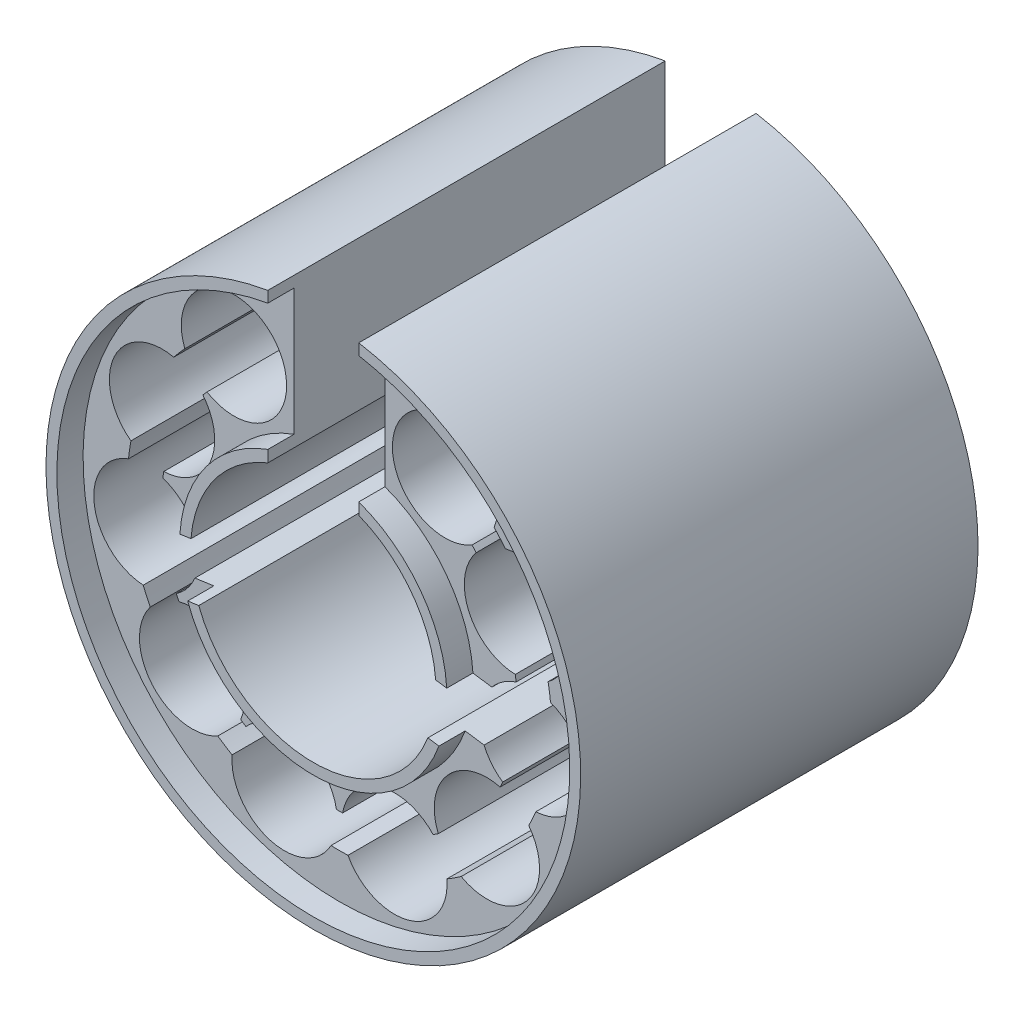
from build123d import *

# Parameters (mm, degrees)
BASIC_SHAPE_SKETCH_R                = 49
BASIC_SHAPE_SKETCH_R_2              = 22.5
BASIC_SHAPE_DEPTH                   = 68.03
SLIT_DEPTH                          = 98.108603635
BATTERY_SLOT_SKETCH_R               = 9.65
BATTERY_SLOT_DEPTH                  = 67.03
PATTERN_BATTERY_SLOT_COUNT          = 5
PATTERN_BATTERY_SLOT_ANGLE          = 130.88
MIRROR_BATTERY_SLOT_COPY_1_SKETCH_R = 9.65
MIRROR_BATTERY_SLOT_COPY_1_DEPTH    = 67.03
MIRROR_BATTERY_SLOT_COPY_2_SKETCH_R = 9.65
MIRROR_BATTERY_SLOT_COPY_2_DEPTH    = 67.03
MIRROR_BATTERY_SLOT_COPY_3_SKETCH_R = 9.65
MIRROR_BATTERY_SLOT_COPY_3_DEPTH    = 67.03
MIRROR_BATTERY_SLOT_COPY_4_SKETCH_R = 9.65
MIRROR_BATTERY_SLOT_COPY_4_DEPTH    = 67.03
BUS_SLIT_DEPTH                      = 67.03
CAP_INNER_LIP_DEPTH                 = 4.8
CAP_OUTER_LIP_DEPTH                 = 4.8
WIRE_SLITS_DEPTH                    = 98.108603635
WIRE_SLITS_DEPTH_BACK               = 67.03
PENNY_HOLE_SKETCH_R                 = 9.65
PENNY_HOLE_DEPTH                    = 100.807559333


with BuildPart() as part:
    # Basic_Shape_Sketch → Basic_Shape (new body)
    with BuildSketch(Plane.XY):
        Circle(BASIC_SHAPE_SKETCH_R)
        Circle(BASIC_SHAPE_SKETCH_R_2, mode=Mode.SUBTRACT)
    extrude(amount=BASIC_SHAPE_DEPTH)

    # Slit_Sketch → Slit (cut, through all)
    with BuildSketch(Plane.XY.offset(68.03)):
        with BuildLine():
            Line((-8.33, 48.286759055), (-8.33, 20.901222452))
            Line((-8.33, 20.901222452), (8.33, 20.901222452))
            Line((8.33, 20.901222452), (8.33, 48.286759055))
            ThreePointArc((8.33, 48.286759055), (0, 56.616759055), (-8.33, 48.286759055))
        make_face()
    extrude(amount=-SLIT_DEPTH, mode=Mode.SUBTRACT)

    # Battery_Slot_Sketch → Battery_Slot (cut)
    with BuildSketch(Plane.XY.offset(68.03)):
        with Locations((-10.069761866, -34.302512969)):
            Circle(BATTERY_SLOT_SKETCH_R)
    battery_slot = extrude(amount=-BATTERY_SLOT_DEPTH, mode=Mode.SUBTRACT)

    # Pattern_Battery_Slot: Battery_Slot ×5 about axis
    pattern_battery_slot_axis = Axis((0, 0, 0), (0, 0, -1))
    for i in range(1, PATTERN_BATTERY_SLOT_COUNT):
        add(battery_slot.rotate(pattern_battery_slot_axis, i * PATTERN_BATTERY_SLOT_ANGLE / (PATTERN_BATTERY_SLOT_COUNT - 1)), mode=Mode.SUBTRACT)

    # Mirror_Battery_Slot: Battery_Slot across plane
    add(battery_slot.mirror(Plane(origin=(0, 0, 0), x_dir=(0, 0, 1), z_dir=(1, 0, 0))), mode=Mode.SUBTRACT)

    # Mirror_Battery_Slot copy 1 sketch → Mirror_Battery_Slot copy 1 (cut)
    with BuildSketch(Plane(origin=(0, 0, 68.03), x_dir=(-0.8413221512344797, -0.5405340302350882, 0), z_dir=(0, 0, 1))):
        with Locations((-10.069761866, 34.302512969)):
            Circle(MIRROR_BATTERY_SLOT_COPY_1_SKETCH_R)
    extrude(amount=-MIRROR_BATTERY_SLOT_COPY_1_DEPTH, mode=Mode.SUBTRACT)

    # Mirror_Battery_Slot copy 2 sketch → Mirror_Battery_Slot copy 2 (cut)
    with BuildSketch(Plane(origin=(0, 0, 68.03), x_dir=(-0.4156459243156256, -0.9095265062656553, 0), z_dir=(0, 0, 1))):
        with Locations((-10.069761866, 34.302512969)):
            Circle(MIRROR_BATTERY_SLOT_COPY_2_SKETCH_R)
    extrude(amount=-MIRROR_BATTERY_SLOT_COPY_2_DEPTH, mode=Mode.SUBTRACT)

    # Mirror_Battery_Slot copy 3 sketch → Mirror_Battery_Slot copy 3 (cut)
    with BuildSketch(Plane(origin=(0, 0, 68.03), x_dir=(0.14193790484034807, -0.9898755634773152, 0), z_dir=(0, 0, 1))):
        with Locations((-10.069761866, 34.302512969)):
            Circle(MIRROR_BATTERY_SLOT_COPY_3_SKETCH_R)
    extrude(amount=-MIRROR_BATTERY_SLOT_COPY_3_DEPTH, mode=Mode.SUBTRACT)

    # Mirror_Battery_Slot copy 4 sketch → Mirror_Battery_Slot copy 4 (cut)
    with BuildSketch(Plane(origin=(0, 0, 68.03), x_dir=(0.6544769311996185, -0.7560819707726999, 0), z_dir=(0, 0, 1))):
        with Locations((-10.069761866, 34.302512969)):
            Circle(MIRROR_BATTERY_SLOT_COPY_4_SKETCH_R)
    extrude(amount=-MIRROR_BATTERY_SLOT_COPY_4_DEPTH, mode=Mode.SUBTRACT)

    # Bus_Slit_Sketch → Bus_Slit (cut)
    with BuildSketch(Plane.XY.offset(68.03)):
        with BuildLine():
            ThreePointArc((-9.754463235, 31.132636766), (0, -32.625), (9.754463235, 31.132636766))
            ThreePointArc((9.754463235, 31.132636766), (10.629095474, 34.20551129), (12.459123069, 36.824392423))
            ThreePointArc((12.459123069, 36.824392423), (0, -38.875), (-12.459123069, 36.824392423))
            ThreePointArc((-12.459123069, 36.824392423), (-10.629095474, 34.20551129), (-9.754463235, 31.132636766))
        make_face()
    extrude(amount=-BUS_SLIT_DEPTH, mode=Mode.SUBTRACT)

    # Cap_Inner_Lip_Sketch → Cap_Inner_Lip (add)
    with BuildSketch(Plane.XY.offset(68.03)):
        with BuildLine():
            Line((-8.33, 23.040423173), (-8.33, 20.901222452))
            ThreePointArc((-8.33, 20.901222452), (0, -22.5), (8.33, 20.901222452))
            Line((8.33, 20.901222452), (8.33, 23.040423173))
            ThreePointArc((8.33, 23.040423173), (0, -24.5), (-8.33, 23.040423173))
        make_face()
    extrude(amount=CAP_INNER_LIP_DEPTH)

    # Cap_Outer_Lip_Sketch → Cap_Outer_Lip (add)
    with BuildSketch(Plane.XY.offset(68.03)):
        with BuildLine():
            Line((-8.33, 48.286759055), (-8.33, 46.255930431))
            ThreePointArc((-8.33, 46.255930431), (0, -47), (8.33, 46.255930431))
            Line((8.33, 46.255930431), (8.33, 48.286759055))
            ThreePointArc((8.33, 48.286759055), (0, -49), (-8.33, 48.286759055))
        make_face()
    extrude(amount=CAP_OUTER_LIP_DEPTH)

    # Wire_Slits_Sketch → Wire_Slits (cut, two sides: drawn at the far end of the back side and taken through both)
    with BuildSketch(Plane.XY.offset(68.03).offset(-WIRE_SLITS_DEPTH_BACK)):
        with BuildLine():
            Line((-34.213144669, 0.12145741), (-17.213144669, 2.571194832))
            ThreePointArc((-17.213144669, 2.571194832), (-11.551118845, -1.664541654), (-15.786855331, -7.326567477))
            Line((-15.786855331, -7.326567477), (-32.786855331, -9.776304899))
            ThreePointArc((-32.786855331, -9.776304899), (-38.448881155, -5.540568413), (-34.213144669, 0.12145741))
        make_face()
        with BuildLine():
            Line((34.213144669, 0.12145741), (17.213144669, 2.571194832))
            ThreePointArc((17.213144669, 2.571194832), (11.551118845, -1.664541654), (15.786855331, -7.326567477))
            Line((15.786855331, -7.326567477), (32.786855331, -9.776304899))
            ThreePointArc((32.786855331, -9.776304899), (38.448881155, -5.540568413), (34.213144669, 0.12145741))
        make_face()
    extrude(amount=WIRE_SLITS_DEPTH + WIRE_SLITS_DEPTH_BACK, mode=Mode.SUBTRACT)

    # Penny Hole Sketch → Penny Hole (cut, through all)
    with BuildSketch(Plane.XY.offset(1)):
        with Locations((-17.602674332, 27.355927262)):
            Circle(PENNY_HOLE_SKETCH_R)
    penny_hole = extrude(amount=-PENNY_HOLE_DEPTH, mode=Mode.SUBTRACT)

    # Penny Hole Mirror: Penny Hole across plane
    add(penny_hole.mirror(Plane(origin=(0, 0, 0), x_dir=(0, 0, 1), z_dir=(1, 0, 0))), mode=Mode.SUBTRACT)


solid = part.part
